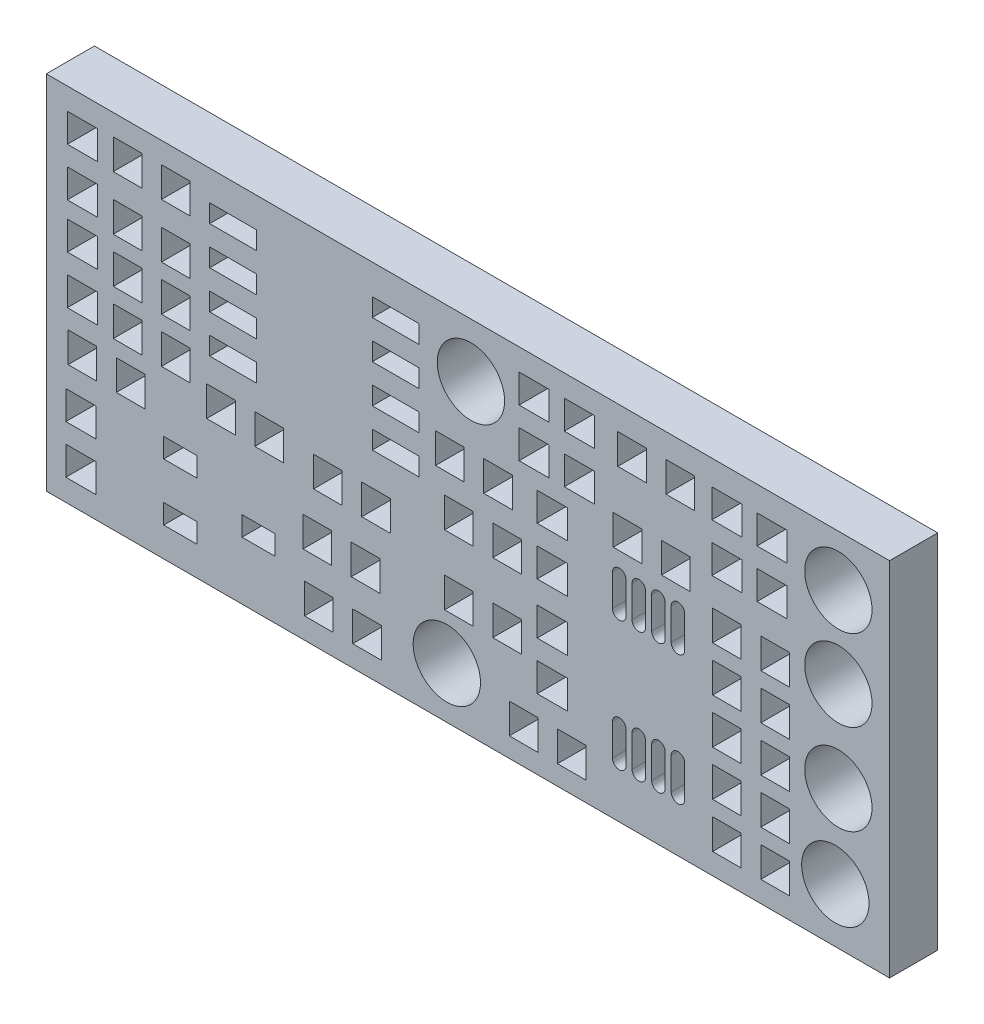
from build123d import *

# Parameters (mm, degrees)
MODEL_W            = 28
MODEL_H            = 12
MODEL_R            = 1.1176
MODEL_W_2          = 1.1
MODEL_H_2          = 0.65
MODEL_W_3          = 1.55
MODEL_H_3          = 0.6
MODEL_W_4          = 0.95
MODEL_H_4          = 1
MODEL_W_5          = 1
MODEL_H_5          = 0.95
BOSS_EXTRU_1_DEPTH = 1.6


with BuildPart() as part:
    # Model → Boss.-Extru.1 (new body)
    with BuildSketch(Plane.XY):
        with Locations((14, 6)):
            Rectangle(MODEL_W, MODEL_H)
        with Locations((26.3, 10.3)):
            Circle(MODEL_R, mode=Mode.SUBTRACT)
        with Locations((26.3, 7.6)):
            Circle(MODEL_R, mode=Mode.SUBTRACT)
        with Locations((26.2, 1.8)):
            Circle(MODEL_R, mode=Mode.SUBTRACT)
        with Locations((26.3, 4.6)):
            Circle(MODEL_R, mode=Mode.SUBTRACT)
        with Locations((13.3, 1.7)):
            Circle(MODEL_R, mode=Mode.SUBTRACT)
        with Locations((14.1, 10.2)):
            Circle(MODEL_R, mode=Mode.SUBTRACT)
        with Locations((4.45, 3.2)):
            Rectangle(MODEL_W_2, MODEL_H_2, mode=Mode.SUBTRACT)
        with Locations((4.45, 1.3)):
            Rectangle(MODEL_W_2, MODEL_H_2, mode=Mode.SUBTRACT)
        with Locations((7.05, 2.25)):
            Rectangle(MODEL_W_2, MODEL_H_2, mode=Mode.SUBTRACT)
        with BuildLine():
            Line((19.25, 2.775), (19.25, 1.725))
            ThreePointArc((19.25, 1.725), (19.025, 1.5), (18.8, 1.725))
            Line((18.8, 1.725), (18.8, 2.775))
            ThreePointArc((18.8, 2.775), (19.025, 3), (19.25, 2.775))
        make_face(mode=Mode.SUBTRACT)
        with BuildLine():
            Line((19.9, 2.775), (19.9, 1.725))
            ThreePointArc((19.9, 1.725), (19.675, 1.5), (19.45, 1.725))
            Line((19.45, 1.725), (19.45, 2.775))
            ThreePointArc((19.45, 2.775), (19.675, 3), (19.9, 2.775))
        make_face(mode=Mode.SUBTRACT)
        with BuildLine():
            Line((20.55, 2.775), (20.55, 1.725))
            ThreePointArc((20.55, 1.725), (20.325, 1.5), (20.1, 1.725))
            Line((20.1, 1.725), (20.1, 2.775))
            ThreePointArc((20.1, 2.775), (20.325, 3), (20.55, 2.775))
        make_face(mode=Mode.SUBTRACT)
        with BuildLine():
            Line((21.2, 2.775), (21.2, 1.725))
            ThreePointArc((21.2, 1.725), (20.975, 1.5), (20.75, 1.725))
            Line((20.75, 1.725), (20.75, 2.775))
            ThreePointArc((20.75, 2.775), (20.975, 3), (21.2, 2.775))
        make_face(mode=Mode.SUBTRACT)
        with BuildLine():
            Line((21.2, 7.075), (21.2, 6.025))
            ThreePointArc((21.2, 6.025), (20.975, 5.8), (20.75, 6.025))
            Line((20.75, 6.025), (20.75, 7.075))
            ThreePointArc((20.75, 7.075), (20.975, 7.3), (21.2, 7.075))
        make_face(mode=Mode.SUBTRACT)
        with BuildLine():
            Line((20.55, 7.075), (20.55, 6.025))
            ThreePointArc((20.55, 6.025), (20.325, 5.8), (20.1, 6.025))
            Line((20.1, 6.025), (20.1, 7.075))
            ThreePointArc((20.1, 7.075), (20.325, 7.3), (20.55, 7.075))
        make_face(mode=Mode.SUBTRACT)
        with BuildLine():
            Line((19.9, 7.075), (19.9, 6.025))
            ThreePointArc((19.9, 6.025), (19.675, 5.8), (19.45, 6.025))
            Line((19.45, 6.025), (19.45, 7.075))
            ThreePointArc((19.45, 7.075), (19.675, 7.3), (19.9, 7.075))
        make_face(mode=Mode.SUBTRACT)
        with BuildLine():
            Line((19.25, 7.075), (19.25, 6.025))
            ThreePointArc((19.25, 6.025), (19.025, 5.8), (18.8, 6.025))
            Line((18.8, 6.025), (18.8, 7.075))
            ThreePointArc((18.8, 7.075), (19.025, 7.3), (19.25, 7.075))
        make_face(mode=Mode.SUBTRACT)
        with Locations((11.6, 6.895)):
            Rectangle(MODEL_W_3, MODEL_H_3, mode=Mode.SUBTRACT)
        with Locations((11.6, 8.165)):
            Rectangle(MODEL_W_3, MODEL_H_3, mode=Mode.SUBTRACT)
        with Locations((11.6, 9.435)):
            Rectangle(MODEL_W_3, MODEL_H_3, mode=Mode.SUBTRACT)
        with Locations((11.6, 10.705)):
            Rectangle(MODEL_W_3, MODEL_H_3, mode=Mode.SUBTRACT)
        with Locations((6.2, 10.705)):
            Rectangle(MODEL_W_3, MODEL_H_3, mode=Mode.SUBTRACT)
        with Locations((6.2, 9.435)):
            Rectangle(MODEL_W_3, MODEL_H_3, mode=Mode.SUBTRACT)
        with Locations((6.2, 8.165)):
            Rectangle(MODEL_W_3, MODEL_H_3, mode=Mode.SUBTRACT)
        with Locations((6.2, 6.895)):
            Rectangle(MODEL_W_3, MODEL_H_3, mode=Mode.SUBTRACT)
        with Locations((21.05, 10.7)):
            Rectangle(MODEL_W_4, MODEL_H_4, mode=Mode.SUBTRACT)
        with Locations((19.45, 10.7)):
            Rectangle(MODEL_W_4, MODEL_H_4, mode=Mode.SUBTRACT)
        with Locations((22.6, 5.7)):
            Rectangle(MODEL_W_4, MODEL_H_4, mode=Mode.SUBTRACT)
        with Locations((24.2, 5.7)):
            Rectangle(MODEL_W_4, MODEL_H_4, mode=Mode.SUBTRACT)
        with Locations((15.85, 1.15)):
            Rectangle(MODEL_W_4, MODEL_H_4, mode=Mode.SUBTRACT)
        with Locations((17.45, 1.15)):
            Rectangle(MODEL_W_4, MODEL_H_4, mode=Mode.SUBTRACT)
        with Locations((16.8, 6.1)):
            Rectangle(MODEL_W_5, MODEL_H_5, mode=Mode.SUBTRACT)
        with Locations((16.8, 7.7)):
            Rectangle(MODEL_W_5, MODEL_H_5, mode=Mode.SUBTRACT)
        with Locations((16.8, 4.4)):
            Rectangle(MODEL_W_5, MODEL_H_5, mode=Mode.SUBTRACT)
        with Locations((16.8, 2.8)):
            Rectangle(MODEL_W_5, MODEL_H_5, mode=Mode.SUBTRACT)
        with Locations((19.3, 8.3)):
            Rectangle(MODEL_W_4, MODEL_H_4, mode=Mode.SUBTRACT)
        with Locations((20.9, 8.3)):
            Rectangle(MODEL_W_4, MODEL_H_4, mode=Mode.SUBTRACT)
        with Locations((24.2, 7.2)):
            Rectangle(MODEL_W_4, MODEL_H_4, mode=Mode.SUBTRACT)
        with Locations((22.6, 7.2)):
            Rectangle(MODEL_W_4, MODEL_H_4, mode=Mode.SUBTRACT)
        with Locations((15.3, 6)):
            Rectangle(MODEL_W_4, MODEL_H_4, mode=Mode.SUBTRACT)
        with Locations((13.7, 6)):
            Rectangle(MODEL_W_4, MODEL_H_4, mode=Mode.SUBTRACT)
        with Locations((15.3, 3.7)):
            Rectangle(MODEL_W_4, MODEL_H_4, mode=Mode.SUBTRACT)
        with Locations((13.7, 3.7)):
            Rectangle(MODEL_W_4, MODEL_H_4, mode=Mode.SUBTRACT)
        with Locations((22.6, 4.2)):
            Rectangle(MODEL_W_4, MODEL_H_4, mode=Mode.SUBTRACT)
        with Locations((24.2, 4.2)):
            Rectangle(MODEL_W_4, MODEL_H_4, mode=Mode.SUBTRACT)
        with Locations((22.6, 2.7)):
            Rectangle(MODEL_W_4, MODEL_H_4, mode=Mode.SUBTRACT)
        with Locations((24.2, 2.7)):
            Rectangle(MODEL_W_4, MODEL_H_4, mode=Mode.SUBTRACT)
        with Locations((24.2, 1.2)):
            Rectangle(MODEL_W_4, MODEL_H_4, mode=Mode.SUBTRACT)
        with Locations((22.6, 1.2)):
            Rectangle(MODEL_W_4, MODEL_H_4, mode=Mode.SUBTRACT)
        with Locations((17.7, 9.2)):
            Rectangle(MODEL_W_5, MODEL_H_5, mode=Mode.SUBTRACT)
        with Locations((17.7, 10.8)):
            Rectangle(MODEL_W_5, MODEL_H_5, mode=Mode.SUBTRACT)
        with Locations((22.6, 9.1)):
            Rectangle(MODEL_W_5, MODEL_H_5, mode=Mode.SUBTRACT)
        with Locations((22.6, 10.7)):
            Rectangle(MODEL_W_5, MODEL_H_5, mode=Mode.SUBTRACT)
        with Locations((24.1, 10.7)):
            Rectangle(MODEL_W_5, MODEL_H_5, mode=Mode.SUBTRACT)
        with Locations((24.1, 9.1)):
            Rectangle(MODEL_W_5, MODEL_H_5, mode=Mode.SUBTRACT)
        with Locations((1.2, 9.2)):
            Rectangle(MODEL_W_5, MODEL_H_5, mode=Mode.SUBTRACT)
        with Locations((1.2, 10.8)):
            Rectangle(MODEL_W_5, MODEL_H_5, mode=Mode.SUBTRACT)
        with Locations((16.2, 10.8)):
            Rectangle(MODEL_W_5, MODEL_H_5, mode=Mode.SUBTRACT)
        with Locations((16.2, 9.2)):
            Rectangle(MODEL_W_5, MODEL_H_5, mode=Mode.SUBTRACT)
        with Locations((1.2, 7.7)):
            Rectangle(MODEL_W_5, MODEL_H_5, mode=Mode.SUBTRACT)
        with Locations((1.2, 6.1)):
            Rectangle(MODEL_W_5, MODEL_H_5, mode=Mode.SUBTRACT)
        with Locations((10.65, 1.2)):
            Rectangle(MODEL_W_4, MODEL_H_4, mode=Mode.SUBTRACT)
        with Locations((9.05, 1.2)):
            Rectangle(MODEL_W_4, MODEL_H_4, mode=Mode.SUBTRACT)
        with Locations((4.3, 10.8)):
            Rectangle(MODEL_W_4, MODEL_H_4, mode=Mode.SUBTRACT)
        with Locations((2.7, 10.8)):
            Rectangle(MODEL_W_4, MODEL_H_4, mode=Mode.SUBTRACT)
        with Locations((1.15, 1.2)):
            Rectangle(MODEL_W_5, MODEL_H_5, mode=Mode.SUBTRACT)
        with Locations((1.15, 2.8)):
            Rectangle(MODEL_W_5, MODEL_H_5, mode=Mode.SUBTRACT)
        with Locations((15, 7.7)):
            Rectangle(MODEL_W_4, MODEL_H_4, mode=Mode.SUBTRACT)
        with Locations((13.4, 7.7)):
            Rectangle(MODEL_W_4, MODEL_H_4, mode=Mode.SUBTRACT)
        with Locations((5.8, 5.25)):
            Rectangle(MODEL_W_4, MODEL_H_4, mode=Mode.SUBTRACT)
        with Locations((7.4, 5.25)):
            Rectangle(MODEL_W_4, MODEL_H_4, mode=Mode.SUBTRACT)
        with Locations((2.8, 4.5)):
            Rectangle(MODEL_W_4, MODEL_H_4, mode=Mode.SUBTRACT)
        with Locations((1.2, 4.5)):
            Rectangle(MODEL_W_4, MODEL_H_4, mode=Mode.SUBTRACT)
        with Locations((10.6, 3.1)):
            Rectangle(MODEL_W_4, MODEL_H_4, mode=Mode.SUBTRACT)
        with Locations((9, 3.1)):
            Rectangle(MODEL_W_4, MODEL_H_4, mode=Mode.SUBTRACT)
        with Locations((9.35, 5)):
            Rectangle(MODEL_W_4, MODEL_H_4, mode=Mode.SUBTRACT)
        with Locations((10.95, 5)):
            Rectangle(MODEL_W_4, MODEL_H_4, mode=Mode.SUBTRACT)
        with Locations((2.7, 7.5)):
            Rectangle(MODEL_W_4, MODEL_H_4, mode=Mode.SUBTRACT)
        with Locations((4.3, 7.5)):
            Rectangle(MODEL_W_4, MODEL_H_4, mode=Mode.SUBTRACT)
        with Locations((2.7, 9)):
            Rectangle(MODEL_W_4, MODEL_H_4, mode=Mode.SUBTRACT)
        with Locations((4.3, 9)):
            Rectangle(MODEL_W_4, MODEL_H_4, mode=Mode.SUBTRACT)
        with Locations((4.3, 6)):
            Rectangle(MODEL_W_4, MODEL_H_4, mode=Mode.SUBTRACT)
        with Locations((2.7, 6)):
            Rectangle(MODEL_W_4, MODEL_H_4, mode=Mode.SUBTRACT)
    extrude(amount=BOSS_EXTRU_1_DEPTH)


solid = part.part
